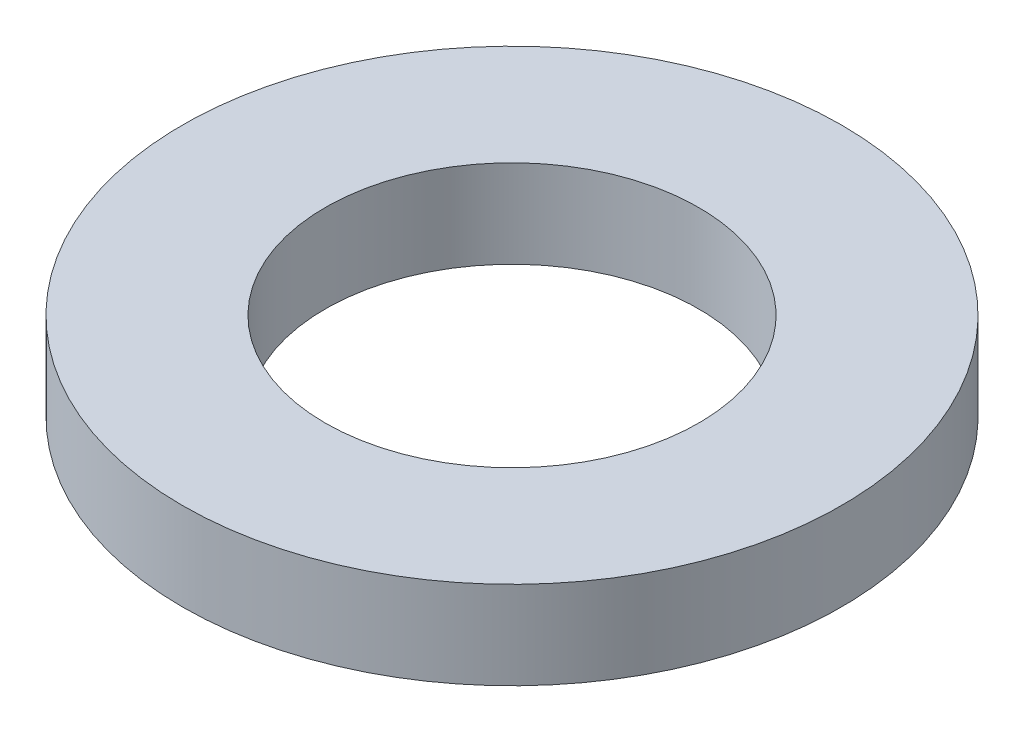
from build123d import *

# Parameters (mm, degrees)
SKETCH_1_R      = 15
SKETCH_1_R_2    = 8.5
EXTRUDE_1_DEPTH = 4


with BuildPart() as part:
    # 草图1 → 凸台-拉伸1 (new body)
    with BuildSketch(Plane(origin=(0, 0, 0), x_dir=(1, 0, 0), z_dir=(0, 1, 0))):
        with Locations(Location((0, 0, 0), (0, 0, 270))):
            Circle(SKETCH_1_R)
        with Locations(Location((0, 0, 0), (0, 0, 270))):
            Circle(SKETCH_1_R_2, mode=Mode.SUBTRACT)
    extrude(amount=EXTRUDE_1_DEPTH)


solid = part.part
